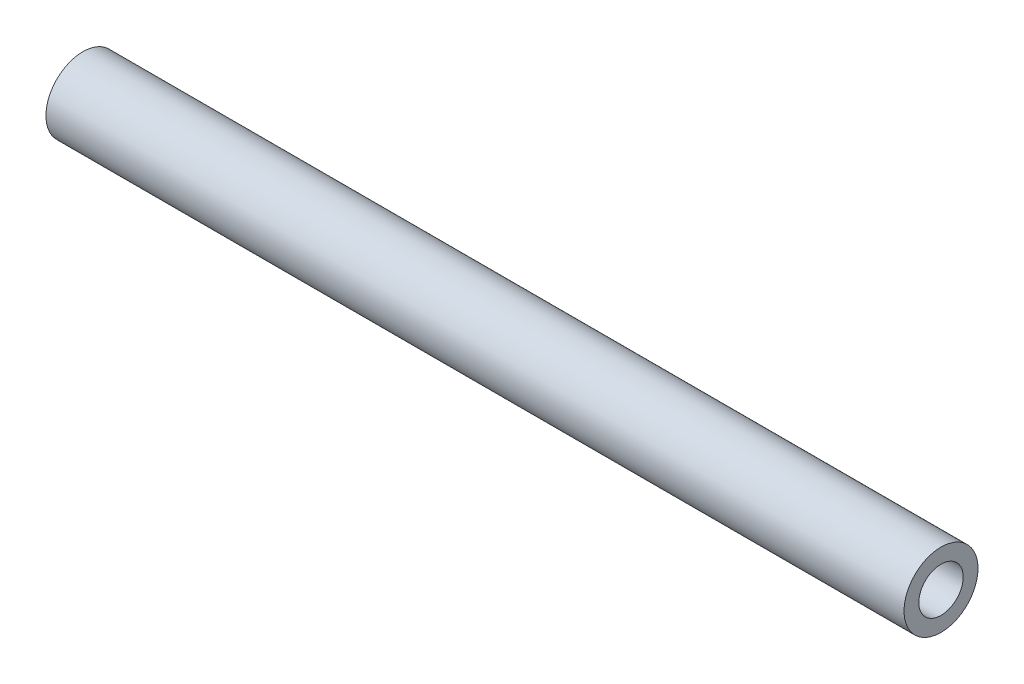
from build123d import *

# Parameters (mm, degrees)
SKETCH1_R           = 7.9375
SKETCH1_R_2         = 4.7625
BOSS_EXTRUDE1_DEPTH = 92.075


with BuildPart() as part:
    # Sketch1 → Boss-Extrude1 (new, symmetric)
    with BuildSketch(Plane(origin=(0, 0, 0), x_dir=(0, 0, -1), z_dir=(1, 0, 0))):
        Circle(SKETCH1_R)
        Circle(SKETCH1_R_2, mode=Mode.SUBTRACT)
    extrude(amount=BOSS_EXTRUDE1_DEPTH, both=True)


solid = part.part
